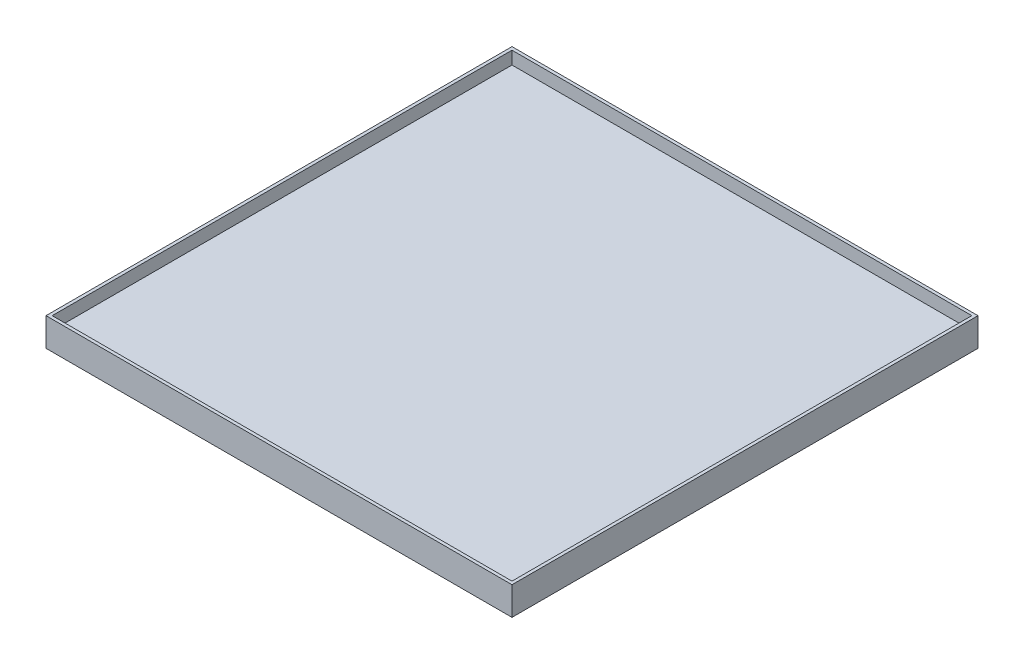
from build123d import *

# Parameters (mm, degrees)
ESQUISSE1_W        = 1810
ESQUISSE1_H        = 1810
BOSS_EXTRU_1_DEPTH = 10
ESQUISSE2_W        = 1810
ESQUISSE2_H        = 1810
ESQUISSE2_W_2      = 1750
ESQUISSE2_H_2      = 1750
BOSS_EXTRU_2_DEPTH = 50
ESQUISSE3_W        = 1750
ESQUISSE3_H        = 30
BOSS_EXTRU_3_DEPTH = 50
ESQUISSE4_W        = 30
ESQUISSE4_H        = 1750
BOSS_EXTRU_4_DEPTH = 50
ESQUISSE5_W        = 1810
ESQUISSE5_H        = 1810
ESQUISSE5_W_2      = 1786
ESQUISSE5_H_2      = 1786
BOSS_EXTRU_5_DEPTH = 50


with BuildPart() as part:
    # Esquisse1 → Boss.-Extru.1 (new body)
    with BuildSketch(Plane(origin=(0, 0, 0), x_dir=(1, 0, 0), z_dir=(0, 1, 0))):
        Rectangle(ESQUISSE1_W, ESQUISSE1_H)
    extrude(amount=BOSS_EXTRU_1_DEPTH)

    # Esquisse2 → Boss.-Extru.2 (add)
    with BuildSketch(Plane(origin=(0, 0, 0), x_dir=(-1, 0, 0), z_dir=(0, -1, 0))):
        Rectangle(ESQUISSE2_W, ESQUISSE2_H)
        Rectangle(ESQUISSE2_W_2, ESQUISSE2_H_2, mode=Mode.SUBTRACT)
    extrude(amount=BOSS_EXTRU_2_DEPTH)

    # Esquisse3 → Boss.-Extru.3 (add)
    with BuildSketch(Plane(origin=(0, 0, 0), x_dir=(-1, 0, 0), z_dir=(0, -1, 0))):
        with Locations((0, -290)):
            Rectangle(ESQUISSE3_W, ESQUISSE3_H)
        with Locations((0, 290)):
            Rectangle(ESQUISSE3_W, ESQUISSE3_H)
    extrude(amount=BOSS_EXTRU_3_DEPTH)

    # Esquisse4 → Boss.-Extru.4 (add)
    with BuildSketch(Plane(origin=(0, 0, 0), x_dir=(-1, 0, 0), z_dir=(0, -1, 0))):
        with Locations((320, 0)):
            Rectangle(ESQUISSE4_W, ESQUISSE4_H)
        with Locations((-320, 0)):
            Rectangle(ESQUISSE4_W, ESQUISSE4_H)
    extrude(amount=BOSS_EXTRU_4_DEPTH)

    # Esquisse5 → Boss.-Extru.5 (add)
    with BuildSketch(Plane(origin=(0, 10, 0), x_dir=(1, 0, 0), z_dir=(0, 1, 0))):
        Rectangle(ESQUISSE5_W, ESQUISSE5_H)
        Rectangle(ESQUISSE5_W_2, ESQUISSE5_H_2, mode=Mode.SUBTRACT)
    extrude(amount=BOSS_EXTRU_5_DEPTH)


solid = part.part
